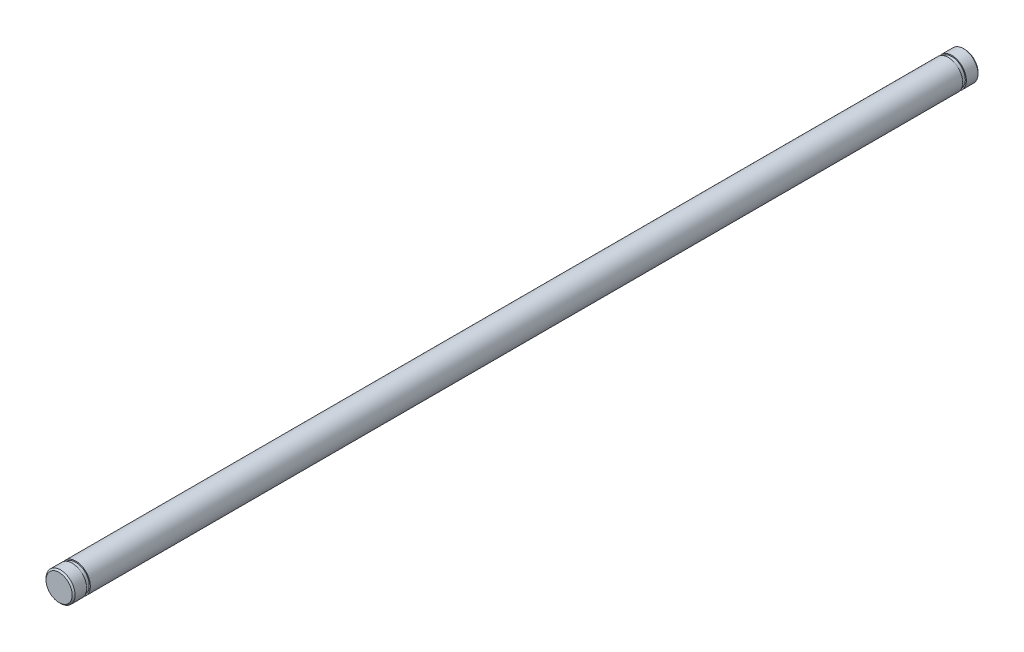
from build123d import *

# Parameters (mm, degrees)
SKIZZE1_R                       = 2
AUFSATZ_LINEAR_AUSTRAGEN1_DEPTH = 62.3
SKIZZE7_W                       = 0.5
SKIZZE7_H                       = 0.15
FASE1_SIZE                      = 0.2


with BuildPart() as part:
    # Skizze1 → Aufsatz-Linear austragen1 (new, symmetric)
    with BuildSketch(Plane.XY):
        Circle(SKIZZE1_R)
    extrude(amount=AUFSATZ_LINEAR_AUSTRAGEN1_DEPTH, both=True)

    # Skizze7 → Schnitt-Rotation1 (revolve, cut)
    with BuildSketch(Plane(origin=(0, 0, 0), x_dir=(0, 0, -1), z_dir=(1, 0, 0)), mode=Mode.PRIVATE) as schnitt_rotation1_sk:
        with Locations((-60.25, 1.925)):
            Rectangle(SKIZZE7_W, SKIZZE7_H)
        with Locations((60.25, 1.925)):
            Rectangle(SKIZZE7_W, SKIZZE7_H)
    revolve(schnitt_rotation1_sk.sketch.rotate(Axis((0, 0, -62.3), (0, 0, 1)), 90), axis=Axis((0, 0, -62.3), (0, 0, 1)), mode=Mode.SUBTRACT)

    # Fase1
    fase1_edges = [part.edges().sort_by_distance(p)[0] for p in [
        (-2, 0, -62.3),
        (-2, 0, 62.3),
    ]]
    chamfer(fase1_edges, length=FASE1_SIZE)


solid = part.part
